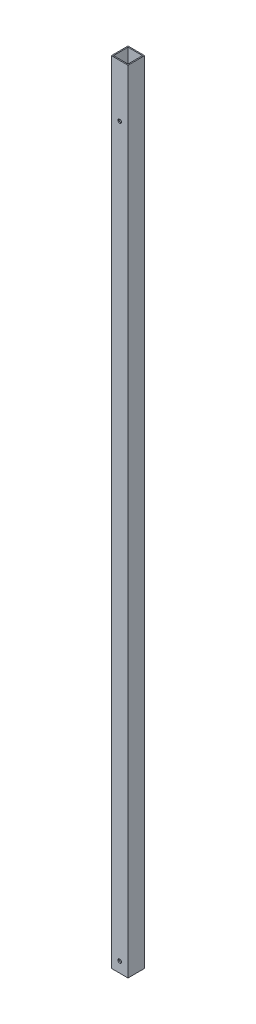
from build123d import *

# Parameters (mm, degrees)
SKETCH1_W           = 15.8
SKETCH1_H           = 15.8
SKETCH1_W_2         = 13.8
SKETCH1_H_2         = 13.8
BOSS_EXTRUDE1_DEPTH = 750
SKETCH3_R           = 1.7
CUT_EXTRUDE1_DEPTH  = 751.208004489


with BuildPart() as part:
    # Sketch1 → Boss-Extrude1 (new body)
    with BuildSketch(Plane(origin=(0, 0, 0), x_dir=(1, 0, 0), z_dir=(0, 1, 0))):
        Rectangle(SKETCH1_W, SKETCH1_H)
        Rectangle(SKETCH1_W_2, SKETCH1_H_2, mode=Mode.SUBTRACT)
    extrude(amount=BOSS_EXTRUDE1_DEPTH)

    # Sketch3 → Cut-Extrude1 (cut, through all)
    with BuildSketch(Plane.XY.offset(7.9)):
        with Locations((0, 10)):
            Circle(SKETCH3_R)
        with Locations((0, 700)):
            Circle(SKETCH3_R)
    extrude(amount=-CUT_EXTRUDE1_DEPTH, mode=Mode.SUBTRACT)


solid = part.part
